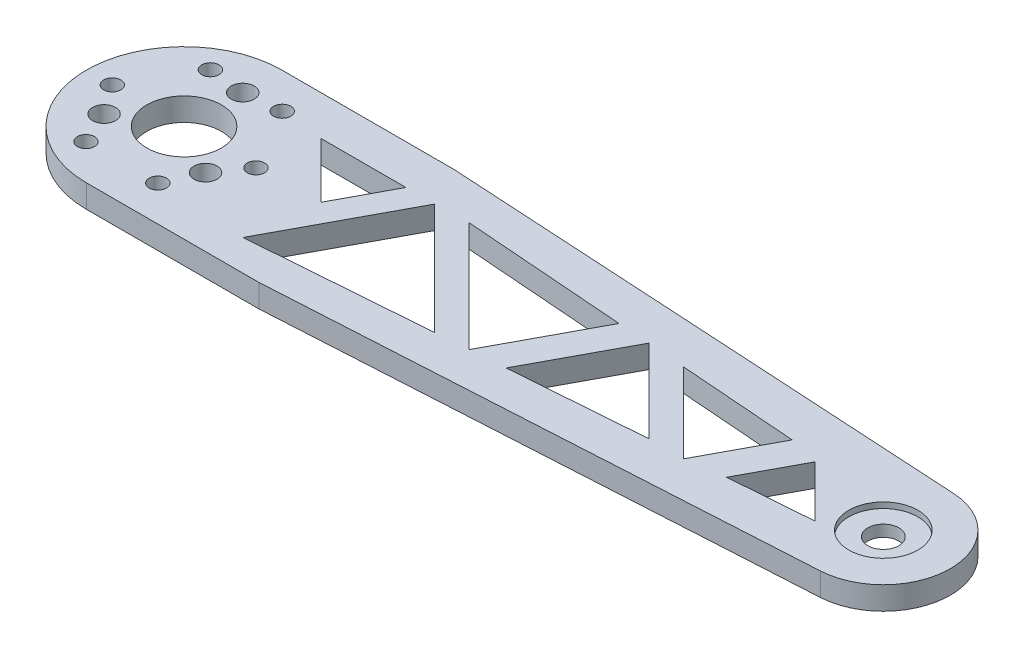
from build123d import *

# Parameters (mm, degrees)
SKETCH_1_R          = 6.5
SKETCH_1_R_2        = 2.7
EXTRUDE_1_DEPTH     = 4
SKETCH_4_R          = 2
SKETCH_4_R_2        = 1.5
CUT_EXTRUDE_4_DEPTH = 135.471393041
SKETCH_5_R          = 6.01
CUT_EXTRUDE_5_DEPTH = 1
CUT_EXTRUDE_START   = -1
SKETCH_6_R          = 6.01
CUT_EXTRUDE_6_DEPTH = 1


with BuildPart() as part:
    # 草图1 → 凸台-拉伸1 (new body)
    with BuildSketch(Plane(origin=(0, 0, 0), x_dir=(1, 0, 0), z_dir=(0, 1, 0))):
        with BuildLine():
            Line((0, 16.99999971), (30, 16.99999971))
            Line((30, 16.99999971), (122.352686729, 11.63070719))
            ThreePointArc((122.352686729, 11.63070719), (133.3325, 0), (122.352686729, -11.63070719))
            Line((122.352686729, -11.63070719), (30, -16.99999971))
            Line((30, -16.99999971), (0, -16.99999971))
            ThreePointArc((0, -16.99999971), (-16.99999971, 0), (0, 16.99999971))
        make_face()
        with Locations(Location((0, 0, 0), (0, 0, 270))):
            Circle(SKETCH_1_R, mode=Mode.SUBTRACT)
        with Locations(Location((121.6825, 0, 0), (0, 0, 270))):
            Circle(SKETCH_1_R_2, mode=Mode.SUBTRACT)
        Polygon((33.501928657, 10.097744769), (52.860659349, -9.261358145), (21.859555817, -11.619111976), align=None, mode=Mode.SUBTRACT)
        Polygon((73.108054682, 7.815553359), (87.546682357, -6.623351936), (64.424639981, -8.381872691), align=None, mode=Mode.SUBTRACT)
        Polygon((79.703760078, 7.21983651), (93.560376125, -6.637045967), (100.155176587, 5.664427182), align=None, mode=Mode.SUBTRACT)
        Polygon((100.078676439, -5.670245314), (105.453109286, 4.354840622), (114.389620729, -4.581842649), align=None, mode=Mode.SUBTRACT)
        Polygon((39.307552848, 10.292124316), (67.540710691, 8.144883461), (58.436595957, -8.837286599), align=None, mode=Mode.SUBTRACT)
        Polygon((13.760637839, 10.097744769), (28.501928657, 10.097744769), (23.357153007, 0.501045083), align=None, mode=Mode.SUBTRACT)
    extrude(amount=EXTRUDE_1_DEPTH)

    # 草图4 → 切除-拉伸4 (cut, through all)
    with BuildSketch(Plane(origin=(0, 4, 0), x_dir=(1, 0, 0), z_dir=(0, 1, 0))):
        with Locations(Location((0, 10.2, 0), (0, 0, 270))):
            Circle(SKETCH_4_R)
        with Locations(Location((8.833459119, -5.1, 0), (0, 0, 270))):
            Circle(SKETCH_4_R)
        with Locations(Location((-8.833459119, -5.1, 0), (0, 0, 270))):
            Circle(SKETCH_4_R)
        with Locations(Location((-6.25, 10.825317547, 0), (0, 0, 270))):
            Circle(SKETCH_4_R_2)
        with Locations(Location((6.25, 10.825317547, 0), (0, 0, 270))):
            Circle(SKETCH_4_R_2)
        with Locations(Location((12.5, 0, 0), (0, 0, 270))):
            Circle(SKETCH_4_R_2)
        with Locations(Location((6.25, -10.825317547, 0), (0, 0, 270))):
            Circle(SKETCH_4_R_2)
        with Locations(Location((-6.25, -10.825317547, 0), (0, 0, 270))):
            Circle(SKETCH_4_R_2)
        with Locations(Location((-12.5, 0, 0), (0, 0, 270))):
            Circle(SKETCH_4_R_2)
    extrude(amount=-CUT_EXTRUDE_4_DEPTH, mode=Mode.SUBTRACT)

    # 草图5 → 切除-拉伸5 (cut)
    with BuildSketch(Plane.XZ):
        with Locations(Location((121.6825, 0, 0), (0, 0, 270))):
            Circle(SKETCH_5_R)
    extrude(amount=-CUT_EXTRUDE_5_DEPTH, mode=Mode.SUBTRACT)

    # 草图6 → 切除-拉伸6 (cut)
    with BuildSketch(Plane(origin=(0, 4, 0), x_dir=(1, 0, 0), z_dir=(0, 1, 0)).offset(CUT_EXTRUDE_START)):
        with Locations(Location((121.6825, 0, 0), (0, 0, 90))):
            Circle(SKETCH_6_R)
    extrude(amount=CUT_EXTRUDE_6_DEPTH, mode=Mode.SUBTRACT)


solid = part.part
